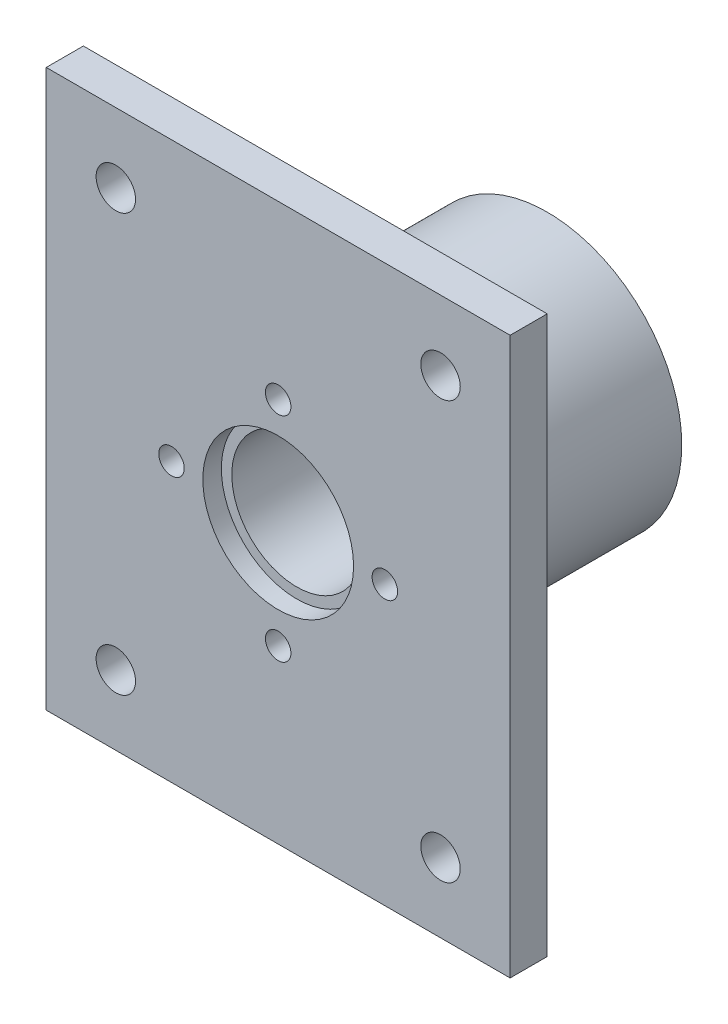
from build123d import *

# Parameters (mm, degrees)
SKETCH1_W               = 100
SKETCH1_H               = 120
BOSS_EXTRUDE1_DEPTH     = 8
SKETCH2_R               = 4.25
CUT_EXTRUDE1_DEPTH      = 8
MIRROR2_COPY_1_SKETCH_R = 4.25
MIRROR2_COPY_1_DEPTH    = 8
SKETCH3_R               = 16.25
CUT_EXTRUDE2_DEPTH      = 4
SKETCH4_R               = 29
BOSS_EXTRUDE2_DEPTH     = 50
SKETCH5_R               = 2.75
CUT_EXTRUDE3_DEPTH      = 70
SKETCH6_R               = 14
CUT_EXTRUDE4_DEPTH      = 31
SKETCH7_R               = 12.5
CUT_EXTRUDE5_DEPTH      = 61
SKETCH8_R               = 4.15
CUT_EXTRUDE6_DEPTH      = 6
CUT_EXTRUDE7_START      = -8.5
SKETCH9_R               = 14
CUT_EXTRUDE7_DEPTH      = 8.5


with BuildPart() as part:
    # Sketch1 → Boss-Extrude1 (new body)
    with BuildSketch(Plane.XY):
        Rectangle(SKETCH1_W, SKETCH1_H)
    extrude(amount=BOSS_EXTRUDE1_DEPTH)

    # Sketch2 → Cut-Extrude1 (cut)
    with BuildSketch(Plane.XY.offset(8)):
        with Locations((35, 45)):
            Circle(SKETCH2_R)
    cut_extrude1 = extrude(amount=-CUT_EXTRUDE1_DEPTH, mode=Mode.SUBTRACT)

    # Mirror1: Cut-Extrude1 across plane
    add(cut_extrude1.mirror(Plane(origin=(0, 0, 0), x_dir=(0, 0, 1), z_dir=(1, 0, 0))), mode=Mode.SUBTRACT)

    # Mirror2: Cut-Extrude1 across plane
    add(cut_extrude1.mirror(Plane.ZX), mode=Mode.SUBTRACT)

    # Mirror2 copy 1 sketch → Mirror2 copy 1 (cut)
    with BuildSketch(Plane(origin=(0, 0, 8), x_dir=(-1, 0, 0), z_dir=(0, 0, 1))):
        with Locations((35, 45)):
            Circle(MIRROR2_COPY_1_SKETCH_R)
    extrude(amount=-MIRROR2_COPY_1_DEPTH, mode=Mode.SUBTRACT)

    # Sketch3 → Cut-Extrude2 (cut)
    with BuildSketch(Plane.XY.offset(8)):
        Circle(SKETCH3_R)
    extrude(amount=-CUT_EXTRUDE2_DEPTH, mode=Mode.SUBTRACT)

    # Sketch4 → Boss-Extrude2 (add)
    with BuildSketch(Plane(origin=(0, 0, 0), x_dir=(-1, 0, 0), z_dir=(0, 0, -1))):
        Circle(SKETCH4_R)
    extrude(amount=BOSS_EXTRUDE2_DEPTH)

    # Sketch5 → Cut-Extrude3 (cut)
    with BuildSketch(Plane.XY.offset(8)):
        with Locations((0, 23)):
            Circle(SKETCH5_R)
        with Locations((23, 0)):
            Circle(SKETCH5_R)
        with Locations((0, -23)):
            Circle(SKETCH5_R)
        with Locations((-23, 0)):
            Circle(SKETCH5_R)
    extrude(amount=-CUT_EXTRUDE3_DEPTH, mode=Mode.SUBTRACT)

    # Sketch6 → Cut-Extrude4 (cut)
    with BuildSketch(Plane.XY.offset(4)):
        Circle(SKETCH6_R)
    extrude(amount=-CUT_EXTRUDE4_DEPTH, mode=Mode.SUBTRACT)

    # Sketch7 → Cut-Extrude5 (cut)
    with BuildSketch(Plane.XY.offset(-27)):
        Circle(SKETCH7_R)
    extrude(amount=-CUT_EXTRUDE5_DEPTH, mode=Mode.SUBTRACT)

    # Sketch8 → Cut-Extrude6 (cut)
    with BuildSketch(Plane(origin=(0, 0, -50), x_dir=(-1, 0, 0), z_dir=(0, 0, -1))):
        with Locations((0, 23)):
            Circle(SKETCH8_R)
        with Locations((23, 0)):
            Circle(SKETCH8_R)
        with Locations((0, -23)):
            Circle(SKETCH8_R)
        with Locations((-23, 0)):
            Circle(SKETCH8_R)
    extrude(amount=-CUT_EXTRUDE6_DEPTH, mode=Mode.SUBTRACT)

    # Sketch9 → Cut-Extrude7 (cut)
    with BuildSketch(Plane(origin=(0, 0, -50), x_dir=(-1, 0, 0), z_dir=(0, 0, -1)).offset(CUT_EXTRUDE7_START)):
        with Locations(Location((0, 0, 0), (0, 0, 180))):
            Circle(SKETCH9_R)
    extrude(amount=CUT_EXTRUDE7_DEPTH, mode=Mode.SUBTRACT)


solid = part.part
